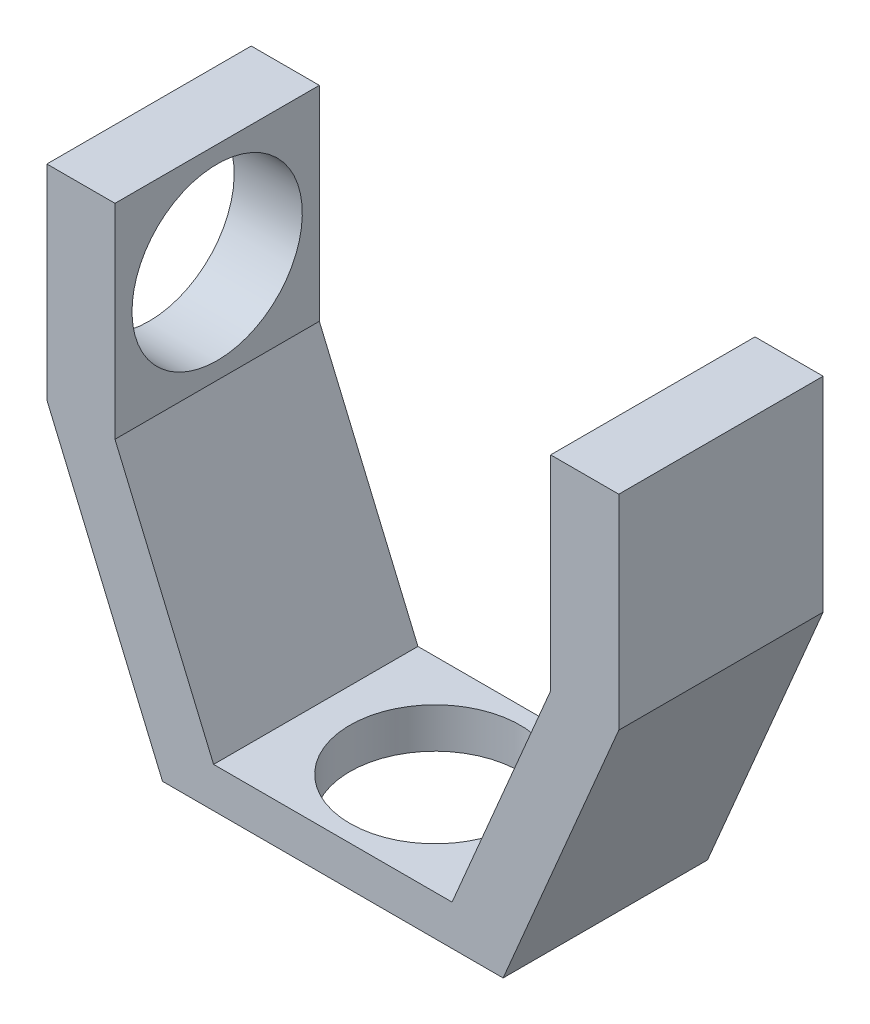
from build123d import *

# Parameters (mm, degrees)
EXTRUDE_2_DEPTH     = 60
CUT_EXTRUDE_2_DEPTH = 189.939286944
SKETCH_7_R          = 25
CUT_EXTRUDE_4_DEPTH = 20
SKETCH_8_R          = 25
CUT_EXTRUDE_5_DEPTH = 20


with BuildPart() as part:
    # 草图1 → 凸台-拉伸2 (new body)
    with BuildSketch(Plane.XY):
        Polygon((-161.784091828, 76.967277349), (-161.784091828, 16.967277349), (-127.826106531, -63.032722651), (-27.826106531, -63.032722651), (6.131878766, 16.967277349), (6.131878766, 76.967277349), align=None)
    extrude(amount=EXTRUDE_2_DEPTH)

    # 草图5 → 切除-拉伸2 (cut, through all)
    with BuildSketch(Plane.XY.offset(60)):
        Polygon((-141.784091828, 76.967277349), (-141.784091828, 16.967277349), (-112.836441026, -51.229114277), (-42.815772036, -51.229114277), (-13.868121234, 16.967277349), (-13.868121234, 76.967277349), align=None)
    extrude(amount=-CUT_EXTRUDE_2_DEPTH, mode=Mode.SUBTRACT)

    # 草图7 → 切除-拉伸4 (cut)
    with BuildSketch(Plane.ZY.offset(161.784091828)):
        with Locations(Location((30, 46.967277349, 0), (0, 0, 270))):
            Circle(SKETCH_7_R)
    extrude(amount=-CUT_EXTRUDE_4_DEPTH, mode=Mode.SUBTRACT)

    # 草图8 → 切除-拉伸5 (cut)
    with BuildSketch(Plane(origin=(0, -51.229114277, 0), x_dir=(1, 0, 0), z_dir=(0, 1, 0))):
        with Locations(Location((-77.815772036, -30, 0), (0, 0, 270))):
            Circle(SKETCH_8_R)
    extrude(amount=-CUT_EXTRUDE_5_DEPTH, mode=Mode.SUBTRACT)


solid = part.part
